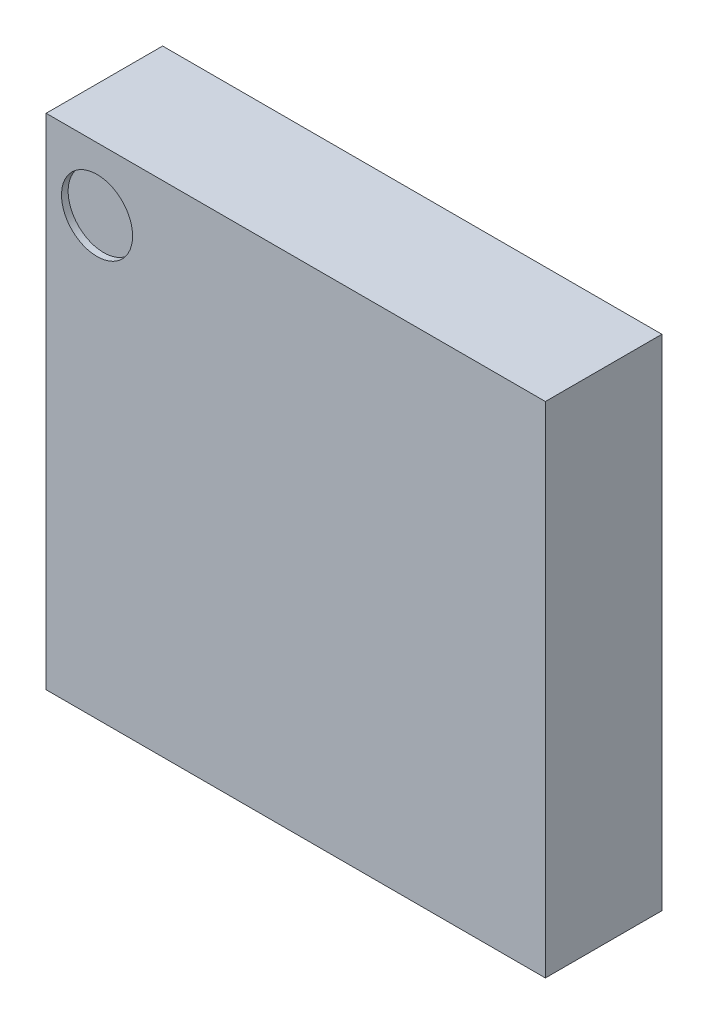
from build123d import *

# Parameters (mm, degrees)
BOSS_EXTRUDE1_START  = 0.1
SKETCH1_W            = 1.5
SKETCH1_H            = 1.5
BOSS_EXTRUDE1_DEPTH  = 0.35
LPATTERN2_COUNT      = 4
LPATTERN2_PITCH      = 0.35
LPATTERN2_COUNT_DIR2 = 4
LPATTERN2_PITCH_DIR2 = 0.35
SKETCH3_R            = 0.106813643
CUT_EXTRUDE1_DEPTH   = 0.02


with BuildPart() as part:
    # Sketch1 → Boss-Extrude1 (new body)
    with BuildSketch(Plane.XY.offset(BOSS_EXTRUDE1_START)):
        Rectangle(SKETCH1_W, SKETCH1_H)
    extrude(amount=BOSS_EXTRUDE1_DEPTH)

    # Sketch4 → Revolve2 (revolve)
    with BuildSketch(Plane(origin=(0, -0.525, 0), x_dir=(-1, 0, 0), z_dir=(0, -1, 0))):
        with BuildLine():
            Line((0.525, -0.17), (0.525, 0.05))
            ThreePointArc((0.525, 0.05), (0.635, -0.06), (0.525, -0.17))
        make_face()
    revolve2 = revolve(axis=Axis((-0.525, -0.525, 0.17), (0, 0, -1)))

    # LPattern2: Revolve2 4 × 4
    with Locations(*[(i * LPATTERN2_PITCH, j * LPATTERN2_PITCH_DIR2, 0) for i in range(LPATTERN2_COUNT) for j in range(LPATTERN2_COUNT_DIR2) if (i, j) != (0, 0)]):
        add(revolve2)

    # Sketch3 → Cut-Extrude1 (cut)
    with BuildSketch(Plane.XY.offset(0.45)):
        with Locations((-0.59701153, 0.560589107)):
            Circle(SKETCH3_R)
    extrude(amount=-CUT_EXTRUDE1_DEPTH, mode=Mode.SUBTRACT)


solid = part.part
